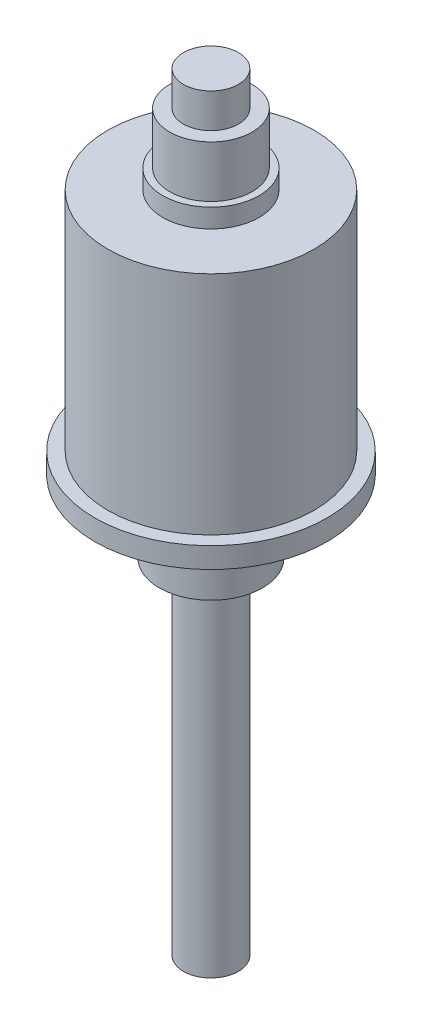
from build123d import *


with BuildPart() as part:
    # Sketch2 → Revolve1 (revolve)
    with BuildSketch(Plane.XY, mode=Mode.PRIVATE) as revolve1_sk:
        Polygon((0, 0), (-4, 0), (-4, -5), (-6, -5), (-6, -12.5), (-7, -12.5), (-7, -15.25), (-14.9815, -15.25), (-14.9815, -48.11), (-16.8815, -48.11), (-16.8815, -51.11), (-9, -51.11), (-9, -53.61), (-7.5, -53.61), (-7.5, -61.61), (-4, -61.61), (-4, -111.61), (0, -111.61), align=None)
    revolve(revolve1_sk.sketch.rotate(Axis((0, 40.033449689, 0), (0, -1, 0)), 270), axis=Axis((0, 40.033449689, 0), (0, -1, 0)))


solid = part.part
